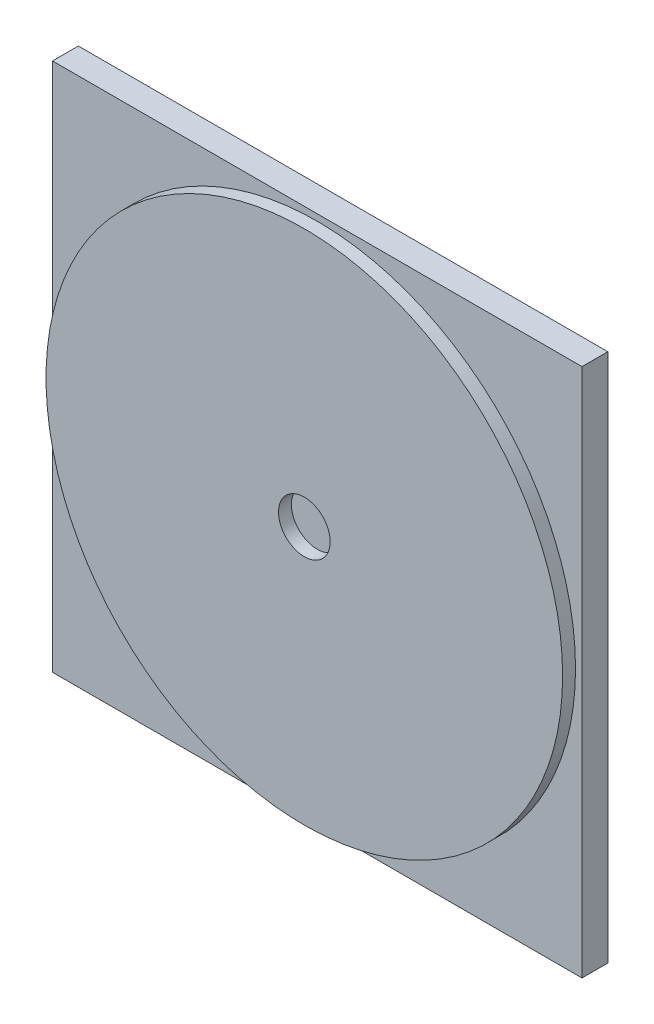
from build123d import *

# Parameters (mm, degrees)
SKETCH1_W           = 41
SKETCH1_H           = 41
BOSS_EXTRUDE1_DEPTH = 2
SKETCH2_R           = 20
BOSS_EXTRUDE2_DEPTH = 1
SKETCH3_R           = 2
CUT_EXTRUDE1_DEPTH  = 1


with BuildPart() as part:
    # Sketch1 → Boss-Extrude1 (new body)
    with BuildSketch(Plane.XY):
        with Locations((-1.555803571, -8.602678571)):
            Rectangle(SKETCH1_W, SKETCH1_H)
    extrude(amount=BOSS_EXTRUDE1_DEPTH)

    # Sketch2 → Boss-Extrude2 (add)
    with BuildSketch(Plane.XY.offset(2)):
        with Locations((-1.555803571, -8.602678571)):
            Circle(SKETCH2_R)
    extrude(amount=BOSS_EXTRUDE2_DEPTH)

    # Sketch3 → Cut-Extrude1 (cut)
    with BuildSketch(Plane.XY.offset(3)):
        with Locations((-1.555803571, -8.602678571)):
            Circle(SKETCH3_R)
    extrude(amount=-CUT_EXTRUDE1_DEPTH, mode=Mode.SUBTRACT)


solid = part.part
